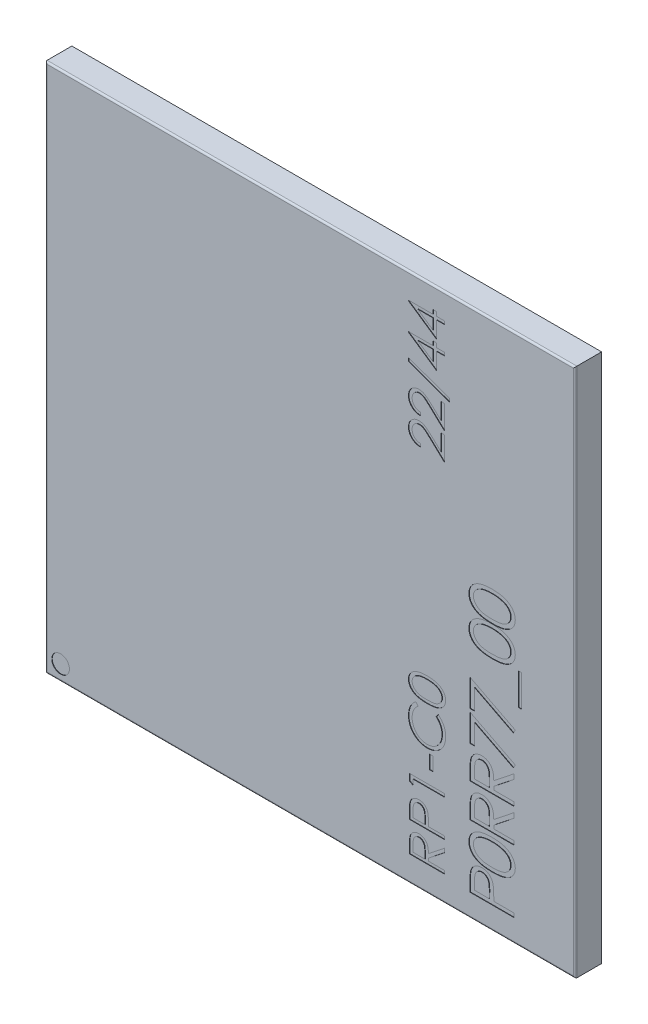
from build123d import *

# Parameters (mm, degrees)
SKETCH1_W                  = 12
SKETCH1_H                  = 12
BOSS_EXTRUDE1_DEPTH        = 0.6
FILLET1_R                  = 0.04
SKETCH5_R                  = 2.5
BOSS_EXTRUDE3_DEPTH        = 0.1
SZKIC2_R                   = 0.2
SZKIC2_W                   = 0.082051282
SZKIC2_H                   = 0.307692307
SZKIC2_W_2                 = 0.064102564
SZKIC2_H_2                 = 0.717948718
WYTNIJ_WYCI_GNI_CIE2_DEPTH = 0.01


with BuildPart() as part:
    # Sketch1 → Boss-Extrude1 (new body)
    with BuildSketch(Plane.XY):
        Rectangle(SKETCH1_W, SKETCH1_H)
    extrude(amount=BOSS_EXTRUDE1_DEPTH)

    # Fillet1
    fillet1_edges = [part.edges().sort_by_distance(p)[0] for p in [
        (6, 0, 0.6),
        (0, 6, 0.6),
        (-6, 0, 0.6),
        (0, -6, 0.6),
    ]]
    fillet(fillet1_edges, radius=FILLET1_R)

    # Szkic2 → Wytnij-wyciągnięcie2 (cut)
    # profile 1 of 21: a face of its own
    with BuildSketch(Plane.XY.offset(0.6)):
        with Locations((-5.654744413, -5.65)):
            Circle(SZKIC2_R)
    # profile 2 of 21: a face of its own
    with BuildSketch(Plane.XY.offset(0.6)):
        with BuildLine():
            Line((2.246735223, -5.423905278), (2.246735223, -5.263809124))
            add(Edge.make_bspline(
                [(2.246735223, -5.263809124), (2.246770785, -5.253125438), (2.246839069, -5.232611576), (2.247219815, -5.2032234), (2.248311096, -5.176520064), (2.249250201, -5.152515529), (2.250962645, -5.131210237), (2.252599364, -5.112538856), (2.254741915, -5.096587382), (2.256731726, -5.086931188), (2.257632658, -5.082559124)],
                knots=[0, 0, 0, 0, 1.410062039, 2.707475311, 3.878576406, 4.937260626, 5.877586885, 6.699081471, 7.410979367, 8, 8, 8, 8], degree=3))
            add(Edge.make_bspline(
                [(2.257632658, -5.082559124), (2.25907878, -5.076706186), (2.261940174, -5.065125169), (2.267988026, -5.048450802), (2.274987006, -5.032562058), (2.283206525, -5.017523495), (2.292712154, -5.003415755), (2.303322871, -4.990073507), (2.315017246, -4.977540059), (2.327900698, -4.965978983), (2.341698728, -4.955477467), (2.356373465, -4.946266021), (2.371864234, -4.938482517), (2.388195162, -4.932374465), (2.405185849, -4.927249138), (2.423009711, -4.92380555), (2.441607247, -4.921660531), (2.454261265, -4.921448624), (2.46067753, -4.921341176)],
                knots=[0, 0, 0, 0, 1.02737844, 2.032840108, 3.019645024, 3.985760442, 4.950801802, 5.916702504, 6.889791722, 7.870143693, 8.864820395, 9.842884691, 10.820524757, 11.815201459, 12.812418953, 13.84314332, 14.906358105, 16, 16, 16, 16], degree=3))
            add(Edge.make_bspline(
                [(2.46067753, -4.921341176), (2.471336983, -4.921676947), (2.492136335, -4.922332123), (2.52232168, -4.928440718), (2.550479237, -4.93844678), (2.576573555, -4.95223496), (2.600095988, -4.969793697), (2.620756663, -4.990896507), (2.638045786, -5.015555161), (2.650034999, -5.038510433), (2.657713378, -5.058787964), (2.663115974, -5.075481293), (2.667290138, -5.093690888), (2.671029596, -5.113242279), (2.673852841, -5.134216828), (2.675920634, -5.156564266), (2.677212988, -5.180300529), (2.677405446, -5.196606602), (2.677504453, -5.204995022)],
                knots=[0, 0, 0, 0, 1.260483769, 2.459530307, 3.627416485, 4.787058657, 5.939039949, 7.08810263, 8.267026773, 9.491475466, 10.141966685, 10.831826277, 11.566392101, 12.351337768, 13.187381173, 14.07005841, 15.007169909, 16, 16, 16, 16], degree=3))
            Line((2.677504453, -5.204995022), (3.046735223, -4.911084765))
            Line((3.046735223, -4.911084765), (3.046735223, -4.999866817))
            Line((3.046735223, -4.999866817), (2.677504453, -5.293777073))
            Line((2.677504453, -5.293777073), (2.677504453, -5.352110407))
            Line((2.677504453, -5.352110407), (3.046735223, -5.352110407))
            Line((3.046735223, -5.352110407), (3.046735223, -5.423905278))
            Line((3.046735223, -5.423905278), (2.246735223, -5.423905278))
        make_face()
        with BuildLine():
            Line((2.328786505, -5.352110407), (2.595453171, -5.352110407))
            Line((2.595453171, -5.352110407), (2.596574966, -5.205636048))
            add(Edge.make_bspline(
                [(2.596574966, -5.205636048), (2.596577993, -5.198797181), (2.596583861, -5.185541509), (2.595670974, -5.166364226), (2.594632582, -5.148508159), (2.59304389, -5.132041839), (2.590997677, -5.116957143), (2.588434097, -5.103264116), (2.58546021, -5.090932236), (2.580809633, -5.076596277), (2.573763409, -5.060398705), (2.562819358, -5.043180338), (2.549669275, -5.028072603), (2.534198097, -5.015768474), (2.51745781, -5.005459619), (2.499276963, -4.99852217), (2.480245326, -4.993898654), (2.467169109, -4.993393181), (2.460517274, -4.993136048)],
                knots=[0, 0, 0, 0, 1.146477201, 2.22219935, 3.21835465, 4.145220026, 4.995151787, 5.769831222, 6.480173269, 7.120302478, 8.295254187, 9.430763426, 10.528629691, 11.636497428, 12.733230534, 13.811001502, 14.886462612, 16, 16, 16, 16], degree=3))
            add(Edge.make_bspline(
                [(2.460517274, -4.993136048), (2.454084296, -4.993411611), (2.441336481, -4.993957678), (2.422664582, -4.998391484), (2.405036577, -5.005971519), (2.388429704, -5.015943089), (2.373590549, -5.028457452), (2.360756092, -5.042849345), (2.350249322, -5.059115998), (2.343266142, -5.074185487), (2.339165228, -5.087762794), (2.336184556, -5.099495145), (2.334115858, -5.112816763), (2.332156424, -5.127667065), (2.330570209, -5.144074392), (2.32947606, -5.162086832), (2.328835277, -5.181592805), (2.32880314, -5.195112042), (2.328786505, -5.202110407)],
                knots=[0, 0, 0, 0, 1.100823979, 2.181431445, 3.263702604, 4.376021382, 5.48638238, 6.575013887, 7.666064109, 8.791843368, 9.405226397, 10.093019944, 10.863016055, 11.711746407, 12.658404307, 13.684961631, 14.801597923, 16, 16, 16, 16], degree=3))
            Line((2.328786505, -5.202110407), (2.328786505, -5.352110407))
        make_face(mode=Mode.SUBTRACT)
    # profile 3 of 21: a face of its own
    with BuildSketch(Plane.XY.offset(0.6)):
        with BuildLine():
            Line((2.246735223, -4.746982201), (2.246735223, -4.590091176))
            add(Edge.make_bspline(
                [(2.246735223, -4.590091176), (2.246747085, -4.579300111), (2.246769813, -4.558623953), (2.247458897, -4.528974798), (2.248379284, -4.502046859), (2.249655145, -4.4778982), (2.251162938, -4.456454521), (2.253277689, -4.437812852), (2.255485757, -4.421826668), (2.25773065, -4.412248051), (2.258754453, -4.407879637)],
                knots=[0, 0, 0, 0, 1.415646017, 2.712440637, 3.8905458, 4.950247383, 5.884950622, 6.709939814, 7.411656543, 8, 8, 8, 8], degree=3))
            add(Edge.make_bspline(
                [(2.258754453, -4.407879637), (2.260268101, -4.402349735), (2.263259729, -4.391420235), (2.269250581, -4.375670728), (2.276358257, -4.360689582), (2.284443397, -4.346409934), (2.29390399, -4.333091865), (2.304110662, -4.320291409), (2.315723011, -4.308460421), (2.328374782, -4.297438652), (2.341905509, -4.287251538), (2.35656103, -4.278692519), (2.371903796, -4.27120878), (2.38814233, -4.265081463), (2.405292396, -4.260524936), (2.423232116, -4.257142173), (2.441981661, -4.254985199), (2.454795517, -4.254779316), (2.461318556, -4.254674509)],
                knots=[0, 0, 0, 0, 0.999549623, 1.97554611, 2.93413192, 3.889860808, 4.833293765, 5.780583482, 6.742559327, 7.719844669, 8.705620613, 9.691528643, 10.674968152, 11.680406189, 12.713313868, 13.765869198, 14.862690416, 16, 16, 16, 16], degree=3))
            add(Edge.make_bspline(
                [(2.461318556, -4.254674509), (2.467896333, -4.254770835), (2.480766199, -4.254959302), (2.499594265, -4.25722131), (2.51758704, -4.260268211), (2.534704629, -4.264953252), (2.550845376, -4.271089406), (2.566255944, -4.278287589), (2.580674154, -4.286969539), (2.594152353, -4.2969455), (2.60670319, -4.308043007), (2.618235714, -4.320215108), (2.62868242, -4.33341266), (2.638066727, -4.347593723), (2.64617102, -4.362896545), (2.653429832, -4.379089037), (2.659526075, -4.396311944), (2.662732946, -4.408230233), (2.664363428, -4.414289894)],
                knots=[0, 0, 0, 0, 1.121902311, 2.195077645, 3.232258892, 4.234102512, 5.217864754, 6.176164875, 7.132989551, 8.084763148, 9.034132444, 9.988522005, 10.94243251, 11.903244335, 12.886203696, 13.894208494, 14.929344452, 16, 16, 16, 16], degree=3))
            add(Edge.make_bspline(
                [(2.664363428, -4.414289894), (2.665428458, -4.419301913), (2.667762533, -4.430286044), (2.670385968, -4.448374675), (2.672537471, -4.469445903), (2.674545271, -4.493428034), (2.675609154, -4.520376995), (2.676858326, -4.550230977), (2.677447742, -4.583091016), (2.677485001, -4.606009869), (2.677504453, -4.617975791)],
                knots=[0, 0, 0, 0, 0.601372724, 1.317943291, 2.144091499, 3.08771165, 4.142394186, 5.309582461, 6.595334295, 8, 8, 8, 8], degree=3))
            Line((2.677504453, -4.617975791), (2.677504453, -4.67518733))
            Line((2.677504453, -4.67518733), (3.046735223, -4.67518733))
            Line((3.046735223, -4.67518733), (3.046735223, -4.746982201))
            Line((3.046735223, -4.746982201), (2.246735223, -4.746982201))
        make_face()
        with BuildLine():
            Line((2.328786505, -4.67518733), (2.595453171, -4.67518733))
            Line((2.595453171, -4.67518733), (2.597215992, -4.535123227))
            add(Edge.make_bspline(
                [(2.597215992, -4.535123227), (2.597219758, -4.528284339), (2.597227027, -4.515082007), (2.596313026, -4.49601151), (2.595271974, -4.478315788), (2.593697444, -4.462061384), (2.591633484, -4.447191265), (2.589066743, -4.433833873), (2.586276288, -4.421789426), (2.581614129, -4.407934623), (2.574445582, -4.392361367), (2.564010163, -4.375348775), (2.550491575, -4.361042449), (2.53533438, -4.348685155), (2.518518036, -4.33868583), (2.50043091, -4.331631706), (2.48134096, -4.327288067), (2.468286065, -4.326745588), (2.461639069, -4.326469381)],
                knots=[0, 0, 0, 0, 1.160746174, 2.240796558, 3.240300023, 4.169675897, 5.012224395, 5.787635701, 6.478238024, 7.109103438, 8.265591281, 9.382545711, 10.479929969, 11.588830844, 12.694575677, 13.785760505, 14.872603606, 16, 16, 16, 16], degree=3))
            add(Edge.make_bspline(
                [(2.461639069, -4.326469381), (2.455207415, -4.326757989), (2.442422083, -4.327331705), (2.423683988, -4.33159586), (2.405801895, -4.338761579), (2.389120975, -4.348693897), (2.373997132, -4.360751299), (2.360836732, -4.3747543), (2.350327837, -4.390738724), (2.343283693, -4.405483978), (2.339159596, -4.41868817), (2.336180911, -4.430100698), (2.334126902, -4.443052583), (2.332161471, -4.457420761), (2.330574977, -4.473186992), (2.329473255, -4.49045148), (2.32883524, -4.509156733), (2.328803143, -4.522141945), (2.328786505, -4.528873227)],
                knots=[0, 0, 0, 0, 1.120540835, 2.227496496, 3.330685923, 4.466139262, 5.598993257, 6.692710361, 7.80064471, 8.921224235, 9.527843361, 10.209888745, 10.975318552, 11.811557897, 12.738105936, 13.73658638, 14.826690375, 16, 16, 16, 16], degree=3))
            Line((2.328786505, -4.528873227), (2.328786505, -4.67518733))
        make_face(mode=Mode.SUBTRACT)
    # profile 4 of 21: a face of its own
    with BuildSketch(Plane.XY.offset(0.6)):
        Polygon((2.246735223, -3.992334765), (2.246735223, -3.844418099), (3.046735223, -3.844418099), (3.046735223, -3.916212971), (2.328786505, -3.916212971), (2.328786505, -4.039289894), align=None)
    # profile 5 of 21: a face of its own
    with BuildSketch(Plane.XY.offset(0.6)):
        with Locations((2.739042915, -3.393136048)):
            Rectangle(SZKIC2_W, SZKIC2_H)
    # profile 6 of 21: a face of its own
    with BuildSketch(Plane.XY.offset(0.6)):
        with BuildLine():
            Line((2.393530094, -2.367495022), (2.441607017, -2.430315535))
            add(Edge.make_bspline(
                [(2.441607017, -2.430315535), (2.436266295, -2.434796927), (2.425656855, -2.443699291), (2.410757635, -2.45802072), (2.396803744, -2.472949335), (2.383705527, -2.488464367), (2.371989427, -2.504924868), (2.360742985, -2.521703647), (2.350896339, -2.539410352), (2.338867428, -2.563771006), (2.32658895, -2.595763156), (2.316028399, -2.635896835), (2.309369158, -2.677850165), (2.308643025, -2.706465665), (2.308273684, -2.721020663)],
                knots=[0, 0, 0, 0, 0.75789156, 1.505565099, 2.245254514, 2.979266606, 3.711207489, 4.440978832, 5.174393176, 5.91211879, 7.394186119, 8.890401545, 10.418332761, 12, 12, 12, 12], degree=3))
            add(Edge.make_bspline(
                [(2.308273684, -2.721020663), (2.308366018, -2.729039703), (2.30854983, -2.745003358), (2.310974773, -2.768694438), (2.314383049, -2.791943135), (2.319440266, -2.814734328), (2.325834008, -2.837039004), (2.333474103, -2.859002981), (2.342926635, -2.880308264), (2.353374248, -2.901249562), (2.365174768, -2.921313433), (2.378046531, -2.940297257), (2.391844673, -2.958132905), (2.406623934, -2.974830419), (2.422306643, -2.990421845), (2.439068499, -3.004710989), (2.456730312, -3.017888764), (2.47530675, -3.029880067), (2.494624801, -3.040675025), (2.51479476, -3.049751906), (2.535471276, -3.057679592), (2.556800932, -3.064051395), (2.578641959, -3.069055608), (2.601084839, -3.072515291), (2.624087021, -3.074912131), (2.639677694, -3.0750951), (2.647536505, -3.07518733)],
                knots=[0, 0, 0, 0, 1.054877232, 2.099964208, 3.13098259, 4.145888998, 5.169474743, 6.183358035, 7.203388855, 8.234598956, 9.261847606, 10.264062591, 11.251197969, 12.227332808, 13.196685059, 14.158975844, 15.123498106, 16.094582253, 17.066912473, 18.032714859, 19.002806091, 19.979168736, 20.95977404, 21.949109834, 22.966205168, 24, 24, 24, 24], degree=3))
            add(Edge.make_bspline(
                [(2.647536505, -3.07518733), (2.659360543, -3.074898238), (2.682575473, -3.074330644), (2.716583926, -3.069300625), (2.749195322, -3.061595621), (2.780188853, -3.050236983), (2.809822887, -3.035951694), (2.837738051, -3.018127591), (2.86434331, -2.997406027), (2.8889943, -2.973574424), (2.911511405, -2.947423831), (2.931340193, -2.919367349), (2.947869287, -2.889473749), (2.961623795, -2.85807339), (2.97219676, -2.82492456), (2.979639989, -2.790086892), (2.984495344, -2.75363615), (2.984960187, -2.728728858), (2.985196761, -2.716052714)],
                knots=[0, 0, 0, 0, 1.029159485, 2.020618137, 2.987588728, 3.942669054, 4.889339625, 5.846988364, 6.821327795, 7.821533711, 8.827683044, 9.822769455, 10.807800696, 11.797391277, 12.803701919, 13.832062008, 14.896664671, 16, 16, 16, 16], degree=3))
            add(Edge.make_bspline(
                [(2.985196761, -2.716052714), (2.984810754, -2.702086385), (2.984051, -2.674597309), (2.977614601, -2.634284617), (2.967178505, -2.595693585), (2.952573266, -2.558822137), (2.933586914, -2.523774218), (2.910570257, -2.490494981), (2.883304352, -2.458956336), (2.862485351, -2.439991472), (2.851863428, -2.430315535)],
                knots=[0, 0, 0, 0, 1.028121516, 2.023589091, 2.998037872, 3.967518031, 4.937445131, 5.927275754, 6.942489185, 8, 8, 8, 8], degree=3))
            Line((2.851863428, -2.430315535), (2.899459581, -2.367495022))
            add(Edge.make_bspline(
                [(2.899459581, -2.367495022), (2.90598243, -2.372550767), (2.918996884, -2.382638041), (2.937348052, -2.398968673), (2.95459361, -2.416184734), (2.970647434, -2.434330476), (2.985575974, -2.453437883), (2.999387339, -2.4735052), (3.012008232, -2.494515299), (3.023601142, -2.516301299), (3.033808306, -2.538913401), (3.042853345, -2.562152541), (3.050341638, -2.586161209), (3.056675893, -2.610737303), (3.061192503, -2.636102782), (3.064789176, -2.66196279), (3.06692299, -2.688559368), (3.06713872, -2.706486977), (3.067248043, -2.715571945)],
                knots=[0, 0, 0, 0, 0.986911346, 1.969095443, 2.935967484, 3.900112155, 4.865124501, 5.834589912, 6.812044781, 7.795288262, 8.784678562, 9.777857908, 10.776141921, 11.791195789, 12.811324908, 13.855933174, 14.913475973, 16, 16, 16, 16], degree=3))
            add(Edge.make_bspline(
                [(3.067248043, -2.715571945), (3.067188159, -2.724176212), (3.067069746, -2.741190084), (3.065151536, -2.766309798), (3.062534453, -2.79076456), (3.058593852, -2.814484474), (3.053943717, -2.837598983), (3.047710287, -2.859898545), (3.04072762, -2.881602593), (3.032520766, -2.902623928), (3.023259925, -2.922980431), (3.012793283, -2.942606445), (3.001208856, -2.961492944), (2.988761997, -2.979825611), (2.975052899, -2.99733363), (2.960271954, -3.014168722), (2.94446898, -3.030425288), (2.933073585, -3.040483045), (2.927344197, -3.045539894)],
                knots=[0, 0, 0, 0, 1.114604814, 2.203992996, 3.262667896, 4.300477797, 5.318619304, 6.316056647, 7.298880507, 8.271930387, 9.238335007, 10.195173496, 11.151986948, 12.108099108, 13.064862484, 14.031167946, 15.010108607, 16, 16, 16, 16], degree=3))
            add(Edge.make_bspline(
                [(2.927344197, -3.045539894), (2.91739172, -3.053638941), (2.897606921, -3.069739257), (2.865544576, -3.090347191), (2.832098581, -3.107928657), (2.79707521, -3.122302604), (2.760460848, -3.133343472), (2.722314397, -3.14110592), (2.682712113, -3.146115016), (2.655778369, -3.146689956), (2.642087787, -3.146982201)],
                knots=[0, 0, 0, 0, 0.994611881, 1.977215934, 2.950189954, 3.921972279, 4.908960509, 5.911694611, 6.938501887, 8, 8, 8, 8], degree=3))
            add(Edge.make_bspline(
                [(2.642087787, -3.146982201), (2.627697969, -3.146626729), (2.5993869, -3.145927358), (2.557838568, -3.139985462), (2.518032534, -3.13042688), (2.480043107, -3.116850448), (2.443670471, -3.099637797), (2.409192482, -3.07837457), (2.376388642, -3.053307795), (2.345756698, -3.024634065), (2.317747704, -2.993190103), (2.293106286, -2.959517231), (2.272599425, -2.923681358), (2.255457445, -2.886077277), (2.242281567, -2.846423407), (2.233057982, -2.804804351), (2.227316927, -2.761298314), (2.226591165, -2.731615474), (2.226222402, -2.716533483)],
                knots=[0, 0, 0, 0, 1.032925535, 2.032216505, 3.007276963, 3.968222605, 4.92396291, 5.891752235, 6.871517503, 7.883894988, 8.900124299, 9.891468569, 10.874487609, 11.85992873, 12.854644235, 13.869047385, 14.917252991, 16, 16, 16, 16], degree=3))
            add(Edge.make_bspline(
                [(2.226222402, -2.716533483), (2.226332701, -2.707341634), (2.226551026, -2.689147295), (2.228676755, -2.662231966), (2.23222783, -2.636029612), (2.237035752, -2.610512676), (2.243090359, -2.585607388), (2.250636339, -2.56136034), (2.259620359, -2.537830908), (2.269879693, -2.515026735), (2.281416256, -2.493101762), (2.29409397, -2.472069754), (2.307848778, -2.452014559), (2.322821498, -2.433040416), (2.338887933, -2.41512411), (2.355859888, -2.39799987), (2.374172875, -2.382166165), (2.387065876, -2.372394355), (2.393530094, -2.367495022)],
                knots=[0, 0, 0, 0, 1.096622143, 2.170653093, 3.219033441, 4.250379162, 5.267604342, 6.275621678, 7.278284436, 8.271072515, 9.257558938, 10.232633088, 11.19973724, 12.157384997, 13.114417402, 14.069920322, 15.032307892, 16, 16, 16, 16], degree=3))
        make_face()
    # profile 7 of 21: a face of its own
    with BuildSketch(Plane.XY.offset(0.6)):
        with BuildLine():
            add(Edge.make_bspline(
                [(2.647055735, -2.27518733), (2.634233475, -2.275112354), (2.60932605, -2.274966713), (2.573032418, -2.273346502), (2.538984352, -2.270654996), (2.507180223, -2.266966453), (2.477611819, -2.262477772), (2.450358162, -2.256485659), (2.425293103, -2.24967131), (2.402334941, -2.241773589), (2.381174251, -2.232862162), (2.361420174, -2.223162665), (2.343101115, -2.212291553), (2.325929992, -2.200865251), (2.310169059, -2.188438932), (2.295636719, -2.175279042), (2.282455526, -2.161122381), (2.270616453, -2.146106254), (2.260235314, -2.130332434), (2.251034937, -2.114231961), (2.243456636, -2.097517153), (2.237257377, -2.080408053), (2.232196779, -2.062868601), (2.228720667, -2.044903275), (2.226537392, -2.026470429), (2.226328395, -2.014029031), (2.226222402, -2.007719381)],
                knots=[0, 0, 0, 0, 1.646148282, 3.197666765, 4.66315463, 6.030252048, 7.307778049, 8.501004361, 9.610818041, 10.641065266, 11.615491391, 12.557119604, 13.464013759, 14.348536654, 15.203310953, 16.038349431, 16.863300206, 17.683791446, 18.490318933, 19.285717724, 20.06220424, 20.843281102, 21.620494212, 22.403315558, 23.190242141, 24, 24, 24, 24], degree=3))
            add(Edge.make_bspline(
                [(2.226222402, -2.007719381), (2.226310688, -2.0013539), (2.226486345, -1.988688834), (2.228958829, -1.970031657), (2.232150136, -1.951699457), (2.237268467, -1.933970368), (2.243393214, -1.916509168), (2.25147472, -1.899750083), (2.260263986, -1.883101426), (2.27098615, -1.867319526), (2.282835906, -1.851932846), (2.296288409, -1.837509441), (2.310971359, -1.823680609), (2.327212228, -1.810968659), (2.344761997, -1.798828776), (2.363767782, -1.787721801), (2.384187464, -1.77741673), (2.405926381, -1.767719855), (2.429565213, -1.759240193), (2.454956518, -1.751701097), (2.482330226, -1.745521531), (2.511533849, -1.740411139), (2.542712061, -1.736444502), (2.575801692, -1.73355765), (2.610823442, -1.7320322), (2.634768101, -1.731744979), (2.647055735, -1.731597586)],
                knots=[0, 0, 0, 0, 0.810910589, 1.61342667, 2.396193133, 3.181089899, 3.963115317, 4.752255436, 5.550715454, 6.36105385, 7.181178335, 8.024612154, 8.872680183, 9.750181803, 10.651284446, 11.591556747, 12.554036451, 13.566402641, 14.62422919, 15.753422176, 16.94128843, 18.199818041, 19.531985927, 20.947085226, 22.433341622, 24, 24, 24, 24], degree=3))
            add(Edge.make_bspline(
                [(2.647055735, -1.731597586), (2.659289664, -1.731748222), (2.683180335, -1.732042386), (2.718046147, -1.733524934), (2.750957417, -1.736515014), (2.781949234, -1.740200665), (2.811035967, -1.745368175), (2.838198662, -1.751594598), (2.863533488, -1.758688681), (2.886858924, -1.767298482), (2.908560118, -1.776769655), (2.928829655, -1.787063668), (2.947830421, -1.798107964), (2.96542648, -1.810065777), (2.981602161, -1.822986825), (2.996335471, -1.836805965), (3.009873537, -1.851355303), (3.021853843, -1.866831684), (3.03265764, -1.882760584), (3.041765863, -1.899410931), (3.049657604, -1.9163566), (3.05610983, -1.933766777), (3.061113607, -1.951614581), (3.06455343, -1.969959346), (3.066971362, -1.988691467), (3.067155497, -2.001354781), (3.067248043, -2.007719381)],
                knots=[0, 0, 0, 0, 1.561645053, 3.049612875, 4.452756685, 5.778837748, 7.032101753, 8.221335837, 9.334924186, 10.387562255, 11.392109817, 12.355697819, 13.287721948, 14.19548756, 15.068665045, 15.927346723, 16.771751757, 17.602390507, 18.423119567, 19.225778204, 20.022010933, 20.807278863, 21.593079439, 22.384715467, 23.188155646, 24, 24, 24, 24], degree=3))
            add(Edge.make_bspline(
                [(3.067248043, -2.007719381), (3.067141448, -2.014028893), (3.066931262, -2.026470018), (3.064756695, -2.044904858), (3.06126058, -2.062797988), (3.056365356, -2.080237704), (3.050373392, -2.097313476), (3.042566843, -2.113792638), (3.033576172, -2.129858355), (3.023337319, -2.145468002), (3.011606266, -2.160327358), (2.998633029, -2.174523483), (2.984084931, -2.187686619), (2.968191016, -2.20000519), (2.950994346, -2.211552289), (2.932483381, -2.22232946), (2.912626513, -2.232232362), (2.891298588, -2.24129604), (2.86817748, -2.249332001), (2.843048528, -2.256402863), (2.815656496, -2.262050143), (2.78614046, -2.266837085), (2.754440445, -2.270672925), (2.720544982, -2.273345385), (2.684518436, -2.274965483), (2.659771179, -2.275112031), (2.647055735, -2.27518733)],
                knots=[0, 0, 0, 0, 0.810927267, 1.598990287, 2.382942141, 3.152806972, 3.926217614, 4.706701772, 5.493896336, 6.292070767, 7.104102563, 7.925577746, 8.761822141, 9.623241997, 10.509042271, 11.423174113, 12.375371989, 13.360203808, 14.400680605, 15.520553799, 16.714061498, 17.994519714, 19.364400916, 20.818312473, 22.365209998, 24, 24, 24, 24], degree=3))
        make_face()
        with BuildLine():
            add(Edge.make_bspline(
                [(2.646735223, -2.203392458), (2.657420597, -2.203364557), (2.67815881, -2.203310407), (2.708241741, -2.201936714), (2.736347234, -2.200024673), (2.76246432, -2.197619216), (2.786501721, -2.194016701), (2.808559367, -2.189929428), (2.828596433, -2.185026994), (2.846788016, -2.179197933), (2.863391718, -2.172558065), (2.878850086, -2.165321224), (2.893346331, -2.157477909), (2.906845282, -2.148867348), (2.91918193, -2.139319305), (2.930668981, -2.129276428), (2.940906924, -2.11828629), (2.953187784, -2.103086111), (2.965877666, -2.083018026), (2.976928263, -2.057733447), (2.983872809, -2.031752063), (2.984755955, -2.014117494), (2.985196761, -2.005315535)],
                knots=[0, 0, 0, 0, 1.459098681, 2.831824031, 4.11146945, 5.306290378, 6.412266529, 7.42953815, 8.369053297, 9.227277979, 10.03601793, 10.809473603, 11.557037441, 12.285528272, 12.993193355, 13.685654407, 14.36688038, 15.041354379, 16.352855396, 17.594313975, 18.799247529, 20, 20, 20, 20], degree=3))
            add(Edge.make_bspline(
                [(2.985196761, -2.005315535), (2.984810783, -1.996462624), (2.984040196, -1.978788205), (2.977314817, -1.952830688), (2.966381486, -1.927839491), (2.953890415, -1.908116703), (2.9419186, -1.893153595), (2.931723244, -1.882428819), (2.920304127, -1.872586313), (2.907984464, -1.863250912), (2.894527847, -1.854688857), (2.879999272, -1.846902992), (2.864358313, -1.839798228), (2.853439517, -1.835750446), (2.847857017, -1.833680919)],
                knots=[0, 0, 0, 0, 1.353621445, 2.702441307, 4.075953605, 5.516772412, 6.261413105, 7.007624062, 7.778524365, 8.566925914, 9.372323995, 10.217594641, 11.088702136, 12, 12, 12, 12], degree=3))
            add(Edge.make_bspline(
                [(2.847857017, -1.833680919), (2.840718791, -1.831269087), (2.826225131, -1.826372032), (2.80374201, -1.820060769), (2.780152807, -1.815090392), (2.755598495, -1.810618766), (2.729897992, -1.807566639), (2.703130818, -1.805109996), (2.675276793, -1.803662982), (2.656352223, -1.80348361), (2.646735223, -1.803392458)],
                knots=[0, 0, 0, 0, 0.884706709, 1.796334032, 2.740027952, 3.714592787, 4.726048262, 5.777819803, 6.87074269, 8, 8, 8, 8], degree=3))
            add(Edge.make_bspline(
                [(2.646735223, -1.803392458), (2.637119777, -1.803518215), (2.618309911, -1.803764224), (2.590762898, -1.804704564), (2.564598839, -1.80713281), (2.539705017, -1.809829751), (2.516219233, -1.813806258), (2.493944879, -1.818093759), (2.473157895, -1.82385403), (2.453532871, -1.830007143), (2.435292643, -1.837049443), (2.418352618, -1.844801873), (2.402629454, -1.853080217), (2.38817173, -1.862075927), (2.374895585, -1.871663703), (2.363106503, -1.882187308), (2.352231009, -1.892978415), (2.340038778, -1.908325644), (2.327509247, -1.928254488), (2.316292473, -1.953223758), (2.309654083, -1.979065877), (2.308733485, -1.996571958), (2.308273684, -2.005315535)],
                knots=[0, 0, 0, 0, 1.313483664, 2.569454835, 3.763100662, 4.901599063, 5.988328865, 7.015709358, 7.99797933, 8.932480776, 9.824041341, 10.666387587, 11.475829342, 12.24921787, 12.990555181, 13.709176526, 14.405678811, 15.080244297, 16.38186033, 17.610124501, 18.806354173, 20, 20, 20, 20], degree=3))
            add(Edge.make_bspline(
                [(2.308273684, -2.005315535), (2.308734629, -2.014165014), (2.309657359, -2.031880095), (2.316261772, -2.057998183), (2.327476429, -2.083136136), (2.340014638, -2.103130697), (2.352184263, -2.118291483), (2.362542015, -2.129049933), (2.373754702, -2.139232091), (2.38620079, -2.148532889), (2.399652178, -2.157092391), (2.413960961, -2.165238822), (2.429448213, -2.172378887), (2.446038895, -2.179040072), (2.46423148, -2.184878856), (2.484341046, -2.189725275), (2.506451368, -2.194137366), (2.530664399, -2.197314791), (2.556787059, -2.200112724), (2.584964428, -2.201915723), (2.615150661, -2.2033167), (2.63599617, -2.203366699), (2.646735223, -2.203392458)],
                knots=[0, 0, 0, 0, 1.207546505, 2.417292871, 3.651582144, 4.952510111, 5.626719005, 6.30238548, 6.989136872, 7.692112372, 8.420316868, 9.164734959, 9.937886623, 10.746308695, 11.604196049, 12.543341915, 13.568754172, 14.680483261, 15.875568977, 17.154711427, 18.534182925, 20, 20, 20, 20], degree=3))
        make_face(mode=Mode.SUBTRACT)
    # profile 8 of 21: a face of its own
    with BuildSketch(Plane.XY.offset(0.6)):
        with BuildLine():
            Line((2.492889069, 2.750453696), (2.492889069, 2.678658824))
            add(Edge.make_bspline(
                [(2.492889069, 2.678658824), (2.483364294, 2.679126745), (2.464657891, 2.680045729), (2.437383855, 2.684349338), (2.411314187, 2.690507252), (2.386658207, 2.699213871), (2.363197908, 2.710026734), (2.341026476, 2.722993597), (2.32022849, 2.738352192), (2.300996754, 2.755770874), (2.283353881, 2.77468942), (2.268118397, 2.795102206), (2.255245786, 2.816552498), (2.244484359, 2.838975218), (2.23640668, 2.862623347), (2.230413163, 2.887282286), (2.226807141, 2.913060374), (2.226419533, 2.930623808), (2.226222402, 2.93955626)],
                knots=[0, 0, 0, 0, 1.10065271, 2.161652631, 3.183658789, 4.190468796, 5.17591951, 6.163126047, 7.15150782, 8.156236427, 9.156009102, 10.134482811, 11.092018607, 12.041330605, 13.001268258, 13.972401359, 14.968799086, 16, 16, 16, 16], degree=3))
            add(Edge.make_bspline(
                [(2.226222402, 2.93955626), (2.226426097, 2.948329009), (2.22682635, 2.965567146), (2.230315304, 2.990715445), (2.235661814, 3.014712953), (2.243584501, 3.037287708), (2.253525739, 3.058671389), (2.265888972, 3.078599231), (2.280089211, 3.097553109), (2.29683909, 3.114602802), (2.314711254, 3.130265001), (2.333798574, 3.14376487), (2.353535451, 3.155391064), (2.374076058, 3.16490674), (2.395487286, 3.172120045), (2.417563857, 3.177464414), (2.440560551, 3.180519543), (2.456128212, 3.180985852), (2.464042915, 3.181222927)],
                knots=[0, 0, 0, 0, 1.111674182, 2.184400057, 3.212814286, 4.223731311, 5.211378316, 6.196328225, 7.191884489, 8.207283132, 9.220262353, 10.201199469, 11.166417575, 12.120932471, 13.06540007, 14.026332106, 14.996573967, 16, 16, 16, 16], degree=3))
            add(Edge.make_bspline(
                [(2.464042915, 3.181222927), (2.475185272, 3.180835889), (2.497274454, 3.180068606), (2.529735065, 3.173505409), (2.561184722, 3.163254439), (2.586496968, 3.150913279), (2.606891264, 3.138459987), (2.62369121, 3.127248987), (2.641775476, 3.114050017), (2.661217256, 3.098975845), (2.681761945, 3.081766871), (2.703828709, 3.062870182), (2.727009518, 3.041797766), (2.742852638, 3.027020936), (2.751062146, 3.019363952)],
                knots=[0, 0, 0, 0, 1.184416499, 2.348048165, 3.509039915, 4.696071444, 5.333504901, 6.05069495, 6.844171097, 7.714965912, 8.667477798, 9.695072654, 10.805644396, 12, 12, 12, 12], degree=3))
            Line((2.751062146, 3.019363952), (2.96468394, 2.819203696))
            Line((2.96468394, 2.819203696), (2.96468394, 3.191479337))
            Line((2.96468394, 3.191479337), (3.046735223, 3.191479337))
            Line((3.046735223, 3.191479337), (3.046735223, 2.647889593))
            Line((3.046735223, 2.647889593), (2.715645479, 2.958146004))
            add(Edge.make_bspline(
                [(2.715645479, 2.958146004), (2.707760152, 2.965699806), (2.692614052, 2.980209115), (2.670501375, 3.000730847), (2.649987195, 3.019162616), (2.631110269, 3.035623734), (2.613594482, 3.049757107), (2.598007121, 3.062299332), (2.583663247, 3.072348609), (2.567036821, 3.083254986), (2.546736863, 3.093818181), (2.521929162, 3.102895291), (2.496391505, 3.108430114), (2.479133896, 3.109094076), (2.470453171, 3.109428055)],
                knots=[0, 0, 0, 0, 1.329631726, 2.553950428, 3.673215718, 4.687767853, 5.603093632, 6.413772471, 7.123043292, 7.734684054, 8.834405432, 9.900288307, 10.943827018, 12, 12, 12, 12], degree=3))
            add(Edge.make_bspline(
                [(2.470453171, 3.109428055), (2.464994566, 3.109282742), (2.454236703, 3.108996359), (2.438463958, 3.106468886), (2.423249143, 3.102649341), (2.408545459, 3.09717614), (2.394500739, 3.089951742), (2.381097886, 3.081157826), (2.368140408, 3.071011526), (2.355991083, 3.059274093), (2.34486395, 3.046380032), (2.335007016, 3.032758489), (2.326769505, 3.018347036), (2.320016706, 3.003206437), (2.314719476, 2.987378901), (2.311048944, 2.970833817), (2.308744376, 2.953616899), (2.308432565, 2.941860671), (2.308273684, 2.935870363)],
                knots=[0, 0, 0, 0, 0.991446411, 1.95395049, 2.89581595, 3.838931463, 4.798493298, 5.75982156, 6.748411868, 7.785213223, 8.824556874, 9.840280684, 10.836137867, 11.835679398, 12.848801643, 13.863922112, 14.911575587, 16, 16, 16, 16], degree=3))
            add(Edge.make_bspline(
                [(2.308273684, 2.935870363), (2.308430671, 2.929612602), (2.308738968, 2.917323394), (2.31107416, 2.899318413), (2.314614312, 2.882023844), (2.320236847, 2.865697736), (2.326880151, 2.849986559), (2.335319753, 2.835225721), (2.345126758, 2.821170148), (2.35649838, 2.808051025), (2.369275219, 2.79606909), (2.383356178, 2.78539336), (2.398639886, 2.776126827), (2.415063613, 2.768030571), (2.432790881, 2.761458605), (2.451754732, 2.756435954), (2.47187396, 2.752461879), (2.485767686, 2.751134208), (2.492889069, 2.750453696)],
                knots=[0, 0, 0, 0, 1.030878251, 2.024474673, 2.987898669, 3.934362936, 4.864849709, 5.795128259, 6.730474222, 7.685293701, 8.650606017, 9.611896181, 10.591709709, 11.591680886, 12.625074257, 13.701333388, 14.821793024, 16, 16, 16, 16], degree=3))
        make_face()
    # profile 9 of 21: a face of its own
    with BuildSketch(Plane.XY.offset(0.6)):
        with BuildLine():
            Line((2.492889069, 3.365838311), (2.492889069, 3.29404344))
            add(Edge.make_bspline(
                [(2.492889069, 3.29404344), (2.483364294, 3.29451136), (2.464657891, 3.295430344), (2.437383855, 3.299733953), (2.411314187, 3.305891868), (2.386658207, 3.314598486), (2.363197908, 3.325411349), (2.341026476, 3.338378213), (2.32022849, 3.353736807), (2.300996754, 3.371155489), (2.283353881, 3.390074035), (2.268118397, 3.410486822), (2.255245786, 3.431937113), (2.244484359, 3.454359833), (2.23640668, 3.478007962), (2.230413163, 3.502666901), (2.226807141, 3.528444989), (2.226419533, 3.546008423), (2.226222402, 3.554940876)],
                knots=[0, 0, 0, 0, 1.10065271, 2.161652631, 3.183658789, 4.190468796, 5.17591951, 6.163126047, 7.15150782, 8.156236427, 9.156009102, 10.134482811, 11.092018607, 12.041330605, 13.001268258, 13.972401359, 14.968799086, 16, 16, 16, 16], degree=3))
            add(Edge.make_bspline(
                [(2.226222402, 3.554940876), (2.226426097, 3.563713624), (2.22682635, 3.580951762), (2.230315304, 3.60610006), (2.235661814, 3.630097569), (2.243584501, 3.652672323), (2.253525739, 3.674056004), (2.265888972, 3.693983846), (2.280089211, 3.712937725), (2.29683909, 3.729987417), (2.314711254, 3.745649617), (2.333798574, 3.759149486), (2.353535451, 3.770775679), (2.374076058, 3.780291355), (2.395487286, 3.787504661), (2.417563857, 3.792849029), (2.440560551, 3.795904159), (2.456128212, 3.796370468), (2.464042915, 3.796607542)],
                knots=[0, 0, 0, 0, 1.111674182, 2.184400057, 3.212814286, 4.223731311, 5.211378316, 6.196328225, 7.191884489, 8.207283132, 9.220262353, 10.201199469, 11.166417575, 12.120932471, 13.06540007, 14.026332106, 14.996573967, 16, 16, 16, 16], degree=3))
            add(Edge.make_bspline(
                [(2.464042915, 3.796607542), (2.475185272, 3.796220505), (2.497274454, 3.795453221), (2.529735065, 3.788890024), (2.561184722, 3.778639054), (2.586496968, 3.766297895), (2.606891264, 3.753844602), (2.62369121, 3.742633602), (2.641775476, 3.729434633), (2.661217256, 3.71436046), (2.681761945, 3.697151486), (2.703828709, 3.678254798), (2.727009518, 3.657182381), (2.742852638, 3.642405551), (2.751062146, 3.634748568)],
                knots=[0, 0, 0, 0, 1.184416499, 2.348048165, 3.509039915, 4.696071444, 5.333504901, 6.05069495, 6.844171097, 7.714965912, 8.667477798, 9.695072654, 10.805644396, 12, 12, 12, 12], degree=3))
            Line((2.751062146, 3.634748568), (2.96468394, 3.434588311))
            Line((2.96468394, 3.434588311), (2.96468394, 3.806863952))
            Line((2.96468394, 3.806863952), (3.046735223, 3.806863952))
            Line((3.046735223, 3.806863952), (3.046735223, 3.263274209))
            Line((3.046735223, 3.263274209), (2.715645479, 3.573530619))
            add(Edge.make_bspline(
                [(2.715645479, 3.573530619), (2.707760152, 3.581084422), (2.692614052, 3.595593731), (2.670501375, 3.616115463), (2.649987195, 3.634547231), (2.631110269, 3.65100835), (2.613594482, 3.665141722), (2.598007121, 3.677683947), (2.583663247, 3.687733225), (2.567036821, 3.698639601), (2.546736863, 3.709202797), (2.521929162, 3.718279907), (2.496391505, 3.723814729), (2.479133896, 3.724478692), (2.470453171, 3.72481267)],
                knots=[0, 0, 0, 0, 1.329631726, 2.553950428, 3.673215718, 4.687767853, 5.603093632, 6.413772471, 7.123043292, 7.734684054, 8.834405432, 9.900288307, 10.943827018, 12, 12, 12, 12], degree=3))
            add(Edge.make_bspline(
                [(2.470453171, 3.72481267), (2.464994566, 3.724667358), (2.454236703, 3.724380975), (2.438463958, 3.721853501), (2.423249143, 3.718033957), (2.408545459, 3.712560755), (2.394500739, 3.705336357), (2.381097886, 3.696542442), (2.368140408, 3.686396142), (2.355991083, 3.674658709), (2.34486395, 3.661764647), (2.335007016, 3.648143104), (2.326769505, 3.633731652), (2.320016706, 3.618591052), (2.314719476, 3.602763517), (2.311048944, 3.586218432), (2.308744376, 3.569001514), (2.308432565, 3.557245286), (2.308273684, 3.551254978)],
                knots=[0, 0, 0, 0, 0.991446411, 1.95395049, 2.89581595, 3.838931463, 4.798493298, 5.75982156, 6.748411868, 7.785213223, 8.824556874, 9.840280684, 10.836137867, 11.835679398, 12.848801643, 13.863922112, 14.911575587, 16, 16, 16, 16], degree=3))
            add(Edge.make_bspline(
                [(2.308273684, 3.551254978), (2.308430671, 3.544997217), (2.308738968, 3.532708009), (2.31107416, 3.514703028), (2.314614312, 3.497408459), (2.320236847, 3.481082352), (2.326880151, 3.465371175), (2.335319753, 3.450610337), (2.345126758, 3.436554763), (2.35649838, 3.42343564), (2.369275219, 3.411453706), (2.383356178, 3.400777975), (2.398639886, 3.391511442), (2.415063613, 3.383415187), (2.432790881, 3.37684322), (2.451754732, 3.37182057), (2.47187396, 3.367846494), (2.485767686, 3.366518824), (2.492889069, 3.365838311)],
                knots=[0, 0, 0, 0, 1.030878251, 2.024474673, 2.987898669, 3.934362936, 4.864849709, 5.795128259, 6.730474222, 7.685293701, 8.650606017, 9.611896181, 10.591709709, 11.591680886, 12.625074257, 13.701333388, 14.821793024, 16, 16, 16, 16], degree=3))
        make_face()
    # profile 10 of 21: a face of its own
    with BuildSketch(Plane.XY.offset(0.6)):
        Polygon((2.226222402, 4.299171645), (3.159555735, 3.96455626), (3.159555735, 3.888915235), (2.226222402, 4.223530619), align=None)
    # profile 11 of 21: a face of its own
    with BuildSketch(Plane.XY.offset(0.6)):
        Polygon((2.226222402, 4.797408824), (2.226222402, 4.811992158), (2.780068556, 4.811992158), (2.780068556, 4.90429985), (2.862119838, 4.90429985), (2.862119838, 4.811992158), (3.046735223, 4.811992158), (3.046735223, 4.740197286), (2.862119838, 4.740197286), (2.862119838, 4.360710106), align=None)
        Polygon((2.780068556, 4.740197286), (2.432632658, 4.740197286), (2.780068556, 4.501735747), align=None, mode=Mode.SUBTRACT)
    # profile 12 of 21: a face of its own
    with BuildSketch(Plane.XY.offset(0.6)):
        Polygon((2.226222402, 5.41279344), (2.226222402, 5.427376773), (2.780068556, 5.427376773), (2.780068556, 5.519684465), (2.862119838, 5.519684465), (2.862119838, 5.427376773), (3.046735223, 5.427376773), (3.046735223, 5.355581901), (2.862119838, 5.355581901), (2.862119838, 4.976094722), align=None)
        Polygon((2.780068556, 5.355581901), (2.432632658, 5.355581901), (2.780068556, 5.117120363), align=None, mode=Mode.SUBTRACT)
    # profile 13 of 21: a face of its own
    with BuildSketch(Plane.XY.offset(0.6)):
        with BuildLine():
            Line((3.618897427, -5.490225819), (3.618897427, -5.294112037))
            add(Edge.make_bspline(
                [(3.618897427, -5.294112037), (3.618912254, -5.280623207), (3.618940665, -5.254778009), (3.619802021, -5.217716564), (3.620952504, -5.184056641), (3.622547331, -5.153870818), (3.624432071, -5.127066219), (3.627075511, -5.103764133), (3.629835595, -5.083781403), (3.632641711, -5.071808131), (3.633921465, -5.066347614)],
                knots=[0, 0, 0, 0, 1.415646017, 2.712440637, 3.8905458, 4.950247383, 5.884950622, 6.709939814, 7.411656543, 8, 8, 8, 8], degree=3))
            add(Edge.make_bspline(
                [(3.633921465, -5.066347614), (3.635813525, -5.059435236), (3.63955306, -5.045773362), (3.647041625, -5.026086477), (3.65592622, -5.007360045), (3.666032645, -4.989510485), (3.677858386, -4.972862898), (3.690616726, -4.956862328), (3.705132163, -4.942073593), (3.720946876, -4.928296383), (3.737860285, -4.91556249), (3.756179686, -4.904863717), (3.775358144, -4.895509043), (3.795656311, -4.887849896), (3.817093894, -4.882154237), (3.839518543, -4.877925784), (3.862955475, -4.875229566), (3.878972795, -4.874972213), (3.887126594, -4.874841204)],
                knots=[0, 0, 0, 0, 0.999549623, 1.97554611, 2.93413192, 3.889860808, 4.833293765, 5.780583482, 6.742559327, 7.719844669, 8.705620613, 9.691528643, 10.674968152, 11.680406189, 12.713313868, 13.765869198, 14.862690416, 16, 16, 16, 16], degree=3))
            add(Edge.make_bspline(
                [(3.887126594, -4.874841204), (3.895348816, -4.874961611), (3.911436148, -4.875197195), (3.93497123, -4.878024706), (3.957462199, -4.881833332), (3.978859185, -4.887689632), (3.999035119, -4.895359825), (4.018298328, -4.904357554), (4.036321092, -4.915209991), (4.05316884, -4.927679943), (4.068857386, -4.941551827), (4.083273042, -4.956766952), (4.096331424, -4.973263893), (4.108061808, -4.990990221), (4.118192174, -5.010118749), (4.127265689, -5.030359364), (4.134885992, -5.051887998), (4.138894581, -5.066785859), (4.140932683, -5.074360435)],
                knots=[0, 0, 0, 0, 1.121902311, 2.195077645, 3.232258892, 4.234102512, 5.217864754, 6.176164875, 7.132989551, 8.084763148, 9.034132444, 9.988522005, 10.94243251, 11.903244335, 12.886203696, 13.894208494, 14.929344452, 16, 16, 16, 16], degree=3))
            add(Edge.make_bspline(
                [(4.140932683, -5.074360435), (4.142263971, -5.080625459), (4.145181565, -5.094355623), (4.148460858, -5.116966411), (4.151150237, -5.143305446), (4.153659987, -5.17328311), (4.154989841, -5.206969311), (4.156551306, -5.244286789), (4.157288077, -5.285361838), (4.15733465, -5.314010404), (4.157358965, -5.328967806)],
                knots=[0, 0, 0, 0, 0.601372724, 1.317943291, 2.144091499, 3.08771165, 4.142394186, 5.309582461, 6.595334295, 8, 8, 8, 8], degree=3))
            Line((4.157358965, -5.328967806), (4.157358965, -5.400482229))
            Line((4.157358965, -5.400482229), (4.618897427, -5.400482229))
            Line((4.618897427, -5.400482229), (4.618897427, -5.490225819))
            Line((4.618897427, -5.490225819), (3.618897427, -5.490225819))
        make_face()
        with BuildLine():
            Line((3.72146153, -5.400482229), (4.054794863, -5.400482229))
            Line((4.054794863, -5.400482229), (4.056998388, -5.225402101))
            add(Edge.make_bspline(
                [(4.056998388, -5.225402101), (4.057003096, -5.216853491), (4.057012183, -5.200350576), (4.055869681, -5.176512454), (4.054568366, -5.154392802), (4.052600203, -5.134074798), (4.050020253, -5.115487149), (4.046811828, -5.098790409), (4.043323759, -5.08373485), (4.03749606, -5.066416346), (4.028535377, -5.046949777), (4.015491102, -5.025684036), (3.998592868, -5.007801129), (3.979646374, -4.992354512), (3.958625944, -4.979855355), (3.936017036, -4.9710377), (3.912154599, -4.965608151), (3.89583598, -4.964930052), (3.887527235, -4.964584794)],
                knots=[0, 0, 0, 0, 1.160746174, 2.240796558, 3.240300023, 4.169675897, 5.012224395, 5.787635701, 6.478238024, 7.109103438, 8.265591281, 9.382545711, 10.479929969, 11.588830844, 12.694575677, 13.785760505, 14.872603606, 16, 16, 16, 16], degree=3))
            add(Edge.make_bspline(
                [(3.887527235, -4.964584794), (3.879487667, -4.964945553), (3.863506002, -4.965662699), (3.840083383, -4.970992893), (3.817730767, -4.979950041), (3.796879617, -4.992365439), (3.777974814, -5.007437191), (3.761524314, -5.024940942), (3.748388195, -5.044921473), (3.739583015, -5.063353039), (3.734427894, -5.07985828), (3.730704537, -5.09412394), (3.728137026, -5.110313796), (3.725680238, -5.128274019), (3.72369712, -5.147981807), (3.722319967, -5.169562417), (3.721522449, -5.192943984), (3.721482328, -5.209175499), (3.72146153, -5.217589601)],
                knots=[0, 0, 0, 0, 1.120540835, 2.227496496, 3.330685923, 4.466139262, 5.598993257, 6.692710361, 7.80064471, 8.921224235, 9.527843361, 10.209888745, 10.975318552, 11.811557897, 12.738105936, 13.73658638, 14.826690375, 16, 16, 16, 16], degree=3))
            Line((3.72146153, -5.217589601), (3.72146153, -5.400482229))
        make_face(mode=Mode.SUBTRACT)
    # profile 14 of 21: a face of its own
    with BuildSketch(Plane.XY.offset(0.6)):
        with BuildLine():
            add(Edge.make_bspline(
                [(4.119298068, -4.844071973), (4.103270243, -4.843978254), (4.072135962, -4.843796202), (4.026768921, -4.841770939), (3.984208838, -4.838406556), (3.944453677, -4.833795877), (3.907493172, -4.828185027), (3.873426101, -4.820694885), (3.842094777, -4.812176949), (3.813397075, -4.802304797), (3.786946212, -4.791165513), (3.762253616, -4.779041142), (3.739354792, -4.765452253), (3.717890889, -4.751169374), (3.698189723, -4.735636476), (3.680024298, -4.719186614), (3.663547806, -4.701490787), (3.648748965, -4.682720629), (3.635772541, -4.663003354), (3.624272071, -4.642877762), (3.614799194, -4.621984253), (3.60705012, -4.600597878), (3.600724373, -4.578673563), (3.596379232, -4.556216904), (3.593650138, -4.533175847), (3.593388892, -4.517624099), (3.593256401, -4.509737037)],
                knots=[0, 0, 0, 0, 1.646148282, 3.197666765, 4.66315463, 6.030252048, 7.307778049, 8.501004361, 9.610818041, 10.641065266, 11.615491391, 12.557119604, 13.464013759, 14.348536654, 15.203310953, 16.038349431, 16.863300206, 17.683791446, 18.490318933, 19.285717724, 20.06220424, 20.843281102, 21.620494212, 22.403315558, 23.190242141, 24, 24, 24, 24], degree=3))
            add(Edge.make_bspline(
                [(3.593256401, -4.509737037), (3.593366758, -4.501780186), (3.59358633, -4.485948854), (3.596676936, -4.462627383), (3.600666069, -4.439712132), (3.607063983, -4.417550771), (3.614719917, -4.395724272), (3.624821799, -4.374775414), (3.635808381, -4.353964594), (3.649211086, -4.334237218), (3.664023282, -4.315003869), (3.68083891, -4.296974612), (3.699192597, -4.279688572), (3.719493684, -4.263798635), (3.741430895, -4.248623781), (3.765188126, -4.234740063), (3.790712729, -4.221858724), (3.817886375, -4.20973763), (3.847434915, -4.199138053), (3.879174046, -4.189714182), (3.913391181, -4.181989725), (3.94989571, -4.175601735), (3.988868475, -4.170643438), (4.030230514, -4.167034874), (4.074007702, -4.165128062), (4.103938525, -4.164769035), (4.119298068, -4.164584794)],
                knots=[0, 0, 0, 0, 0.810910589, 1.61342667, 2.396193133, 3.181089899, 3.963115317, 4.752255436, 5.550715454, 6.36105385, 7.181178335, 8.024612154, 8.872680183, 9.750181803, 10.651284446, 11.591556747, 12.554036451, 13.566402641, 14.62422919, 15.753422176, 16.94128843, 18.199818041, 19.531985927, 20.947085226, 22.433341622, 24, 24, 24, 24], degree=3))
            add(Edge.make_bspline(
                [(4.119298068, -4.164584794), (4.134590479, -4.164773088), (4.164453817, -4.165140794), (4.208036082, -4.166993978), (4.24917517, -4.170731579), (4.287914941, -4.175338642), (4.324273357, -4.18179803), (4.358226726, -4.189581059), (4.389895259, -4.198448662), (4.419052054, -4.209210914), (4.446178546, -4.22104988), (4.471515468, -4.233917396), (4.495266426, -4.247722766), (4.517261499, -4.262670033), (4.537481101, -4.278821343), (4.555897738, -4.296095267), (4.57282032, -4.31428194), (4.587795702, -4.333627416), (4.601300449, -4.353538541), (4.612685728, -4.374351475), (4.622550404, -4.395533562), (4.630615686, -4.417296282), (4.636870407, -4.439606037), (4.641170187, -4.462536994), (4.644192602, -4.485952145), (4.64442277, -4.501781287), (4.644538453, -4.509737037)],
                knots=[0, 0, 0, 0, 1.561645053, 3.049612875, 4.452756685, 5.778837748, 7.032101753, 8.221335837, 9.334924186, 10.387562255, 11.392109817, 12.355697819, 13.287721948, 14.19548756, 15.068665045, 15.927346723, 16.771751757, 17.602390507, 18.423119567, 19.225778204, 20.022010933, 20.807278863, 21.593079439, 22.384715467, 23.188155646, 24, 24, 24, 24], degree=3))
            add(Edge.make_bspline(
                [(4.644538453, -4.509737037), (4.644405208, -4.517623927), (4.644142476, -4.533175334), (4.641424267, -4.556218884), (4.637054123, -4.578585296), (4.630935094, -4.600384941), (4.623445139, -4.621729656), (4.613686952, -4.642328608), (4.602448614, -4.662410755), (4.589650047, -4.681922814), (4.574986231, -4.700497008), (4.558769685, -4.718242165), (4.540584562, -4.734696085), (4.520717169, -4.750094298), (4.499221332, -4.764528172), (4.476082625, -4.777999636), (4.45126154, -4.790378264), (4.424601634, -4.801707861), (4.395700249, -4.811752813), (4.364289059, -4.82059139), (4.330049019, -4.827650489), (4.293153974, -4.833634168), (4.253528955, -4.838428967), (4.211159626, -4.841769542), (4.166126444, -4.843794665), (4.135192372, -4.84397785), (4.119298068, -4.844071973)],
                knots=[0, 0, 0, 0, 0.810927267, 1.598990287, 2.382942141, 3.152806972, 3.926217614, 4.706701772, 5.493896336, 6.292070767, 7.104102563, 7.925577746, 8.761822141, 9.623241997, 10.509042271, 11.423174113, 12.375371989, 13.360203808, 14.400680605, 15.520553799, 16.714061498, 17.994519714, 19.364400916, 20.818312473, 22.365209998, 24, 24, 24, 24], degree=3))
        make_face()
        with BuildLine():
            add(Edge.make_bspline(
                [(4.118897427, -4.754328383), (4.132254145, -4.754293507), (4.158176911, -4.75422582), (4.195780575, -4.752508703), (4.230912441, -4.750118652), (4.263558799, -4.747111831), (4.293605549, -4.742608688), (4.321177608, -4.737499597), (4.34622394, -4.731371554), (4.368963419, -4.724085227), (4.389718047, -4.715785392), (4.409041007, -4.706739341), (4.427161313, -4.696935197), (4.444035002, -4.686171996), (4.459455812, -4.674236942), (4.473814625, -4.661683346), (4.486612054, -4.647945674), (4.501963129, -4.62894545), (4.517825482, -4.603860344), (4.531638728, -4.57225462), (4.54031941, -4.539777889), (4.541423343, -4.517734679), (4.54197435, -4.506732229)],
                knots=[0, 0, 0, 0, 1.459098681, 2.831824031, 4.11146945, 5.306290378, 6.412266529, 7.42953815, 8.369053297, 9.227277979, 10.03601793, 10.809473603, 11.557037441, 12.285528272, 12.993193355, 13.685654407, 14.36688038, 15.041354379, 16.352855396, 17.594313975, 18.799247529, 20, 20, 20, 20], degree=3))
            add(Edge.make_bspline(
                [(4.54197435, -4.506732229), (4.541491877, -4.495666091), (4.540528644, -4.473573068), (4.53212192, -4.44112617), (4.518455257, -4.409887174), (4.502841418, -4.38523369), (4.487876648, -4.366529804), (4.475132454, -4.353123834), (4.460858557, -4.340820702), (4.445458979, -4.329151452), (4.428638208, -4.318448883), (4.410477489, -4.308716551), (4.390926291, -4.299835596), (4.377277794, -4.294775868), (4.370299671, -4.29218896)],
                knots=[0, 0, 0, 0, 1.353621445, 2.702441307, 4.075953605, 5.516772412, 6.261413105, 7.007624062, 7.778524365, 8.566925914, 9.372323995, 10.217594641, 11.088702136, 12, 12, 12, 12], degree=3))
            add(Edge.make_bspline(
                [(4.370299671, -4.29218896), (4.361376888, -4.289174169), (4.343259812, -4.283052851), (4.315155912, -4.275163773), (4.285669408, -4.268950802), (4.254976517, -4.263361269), (4.222850888, -4.25954611), (4.189391922, -4.256475306), (4.15457439, -4.254666538), (4.130918678, -4.254442324), (4.118897427, -4.254328383)],
                knots=[0, 0, 0, 0, 0.884706709, 1.796334032, 2.740027952, 3.714592787, 4.726048262, 5.777819803, 6.87074269, 8, 8, 8, 8], degree=3))
            add(Edge.make_bspline(
                [(4.118897427, -4.254328383), (4.106878121, -4.25448558), (4.083365788, -4.254793091), (4.048932022, -4.255968516), (4.016226947, -4.259003823), (3.98510967, -4.262375), (3.95575244, -4.267345634), (3.927909497, -4.27270501), (3.901925768, -4.279905348), (3.877394487, -4.28759674), (3.854594203, -4.296399615), (3.833419172, -4.306090152), (3.813765216, -4.316438082), (3.795693061, -4.32768272), (3.77909788, -4.33966744), (3.764361527, -4.352821946), (3.75076716, -4.36631083), (3.735526871, -4.385494866), (3.719864958, -4.410405921), (3.70584399, -4.441617509), (3.697546002, -4.473920157), (3.696395255, -4.495802758), (3.695820504, -4.506732229)],
                knots=[0, 0, 0, 0, 1.313483664, 2.569454835, 3.763100662, 4.901599063, 5.988328865, 7.015709358, 7.99797933, 8.932480776, 9.824041341, 10.666387587, 11.475829342, 12.24921787, 12.990555181, 13.709176526, 14.405678811, 15.080244297, 16.38186033, 17.610124501, 18.806354173, 20, 20, 20, 20], degree=3))
            add(Edge.make_bspline(
                [(3.695820504, -4.506732229), (3.696396685, -4.517794079), (3.697550098, -4.539937929), (3.705805614, -4.572585539), (3.719823935, -4.60400798), (3.735496696, -4.629001183), (3.750708727, -4.647952165), (3.763655917, -4.661400227), (3.777671776, -4.674127925), (3.793229387, -4.685753922), (3.810043621, -4.6964533), (3.8279296, -4.706636339), (3.847288665, -4.71556142), (3.868027018, -4.723887901), (3.890767748, -4.731186381), (3.915904706, -4.737244405), (3.943542609, -4.742759518), (3.973808898, -4.746731299), (4.006462223, -4.750228716), (4.041683933, -4.752482465), (4.079416725, -4.754233686), (4.105473611, -4.754296185), (4.118897427, -4.754328383)],
                knots=[0, 0, 0, 0, 1.207546505, 2.417292871, 3.651582144, 4.952510111, 5.626719005, 6.30238548, 6.989136872, 7.692112372, 8.420316868, 9.164734959, 9.937886623, 10.746308695, 11.604196049, 12.543341915, 13.568754172, 14.680483261, 15.875568977, 17.154711427, 18.534182925, 20, 20, 20, 20], degree=3))
        make_face(mode=Mode.SUBTRACT)
    # profile 15 of 21: a face of its own
    with BuildSketch(Plane.XY.offset(0.6)):
        with BuildLine():
            Line((3.618897427, -4.069712999), (3.618897427, -3.869592806))
            add(Edge.make_bspline(
                [(3.618897427, -3.869592806), (3.61894188, -3.856238198), (3.619027235, -3.830595871), (3.619503167, -3.793860651), (3.620867269, -3.760481481), (3.62204115, -3.730475812), (3.624181705, -3.703844197), (3.626227604, -3.680504971), (3.628905793, -3.660565628), (3.631393056, -3.648495385), (3.632519222, -3.643030306)],
                knots=[0, 0, 0, 0, 1.410062039, 2.707475311, 3.878576406, 4.937260626, 5.877586885, 6.699081471, 7.410979367, 8, 8, 8, 8], degree=3))
            add(Edge.make_bspline(
                [(3.632519222, -3.643030306), (3.634326874, -3.635714134), (3.637903616, -3.621237862), (3.645463431, -3.600394904), (3.654212156, -3.580533973), (3.664486555, -3.56173577), (3.676368591, -3.544101095), (3.689631988, -3.527423284), (3.704249956, -3.511756474), (3.720354271, -3.49730513), (3.737601808, -3.484178235), (3.75594523, -3.472663926), (3.775308691, -3.462934547), (3.795722351, -3.455299482), (3.81696071, -3.448892823), (3.839240538, -3.444588338), (3.862487458, -3.441907064), (3.87830498, -3.441642181), (3.886325312, -3.44150787)],
                knots=[0, 0, 0, 0, 1.02737844, 2.032840108, 3.019645024, 3.985760442, 4.950801802, 5.916702504, 6.889791722, 7.870143693, 8.864820395, 9.842884691, 10.820524757, 11.815201459, 12.812418953, 13.84314332, 14.906358105, 16, 16, 16, 16], degree=3))
            add(Edge.make_bspline(
                [(3.886325312, -3.44150787), (3.899649627, -3.441927584), (3.925648818, -3.442746554), (3.963380498, -3.450382298), (3.998577445, -3.462889875), (4.031195342, -3.480125101), (4.060598384, -3.502073523), (4.086424228, -3.528452034), (4.108035631, -3.559275352), (4.123022147, -3.587969442), (4.132620121, -3.613316356), (4.139373366, -3.634183017), (4.144591071, -3.656945011), (4.149265394, -3.681384249), (4.15279445, -3.707602436), (4.155379191, -3.735536733), (4.156994633, -3.765207062), (4.157235206, -3.785589654), (4.157358965, -3.796075178)],
                knots=[0, 0, 0, 0, 1.260483769, 2.459530307, 3.627416485, 4.787058657, 5.939039949, 7.08810263, 8.267026773, 9.491475466, 10.141966685, 10.831826277, 11.566392101, 12.351337768, 13.187381173, 14.07005841, 15.007169909, 16, 16, 16, 16], degree=3))
            Line((4.157358965, -3.796075178), (4.618897427, -3.428687358))
            Line((4.618897427, -3.428687358), (4.618897427, -3.539664922))
            Line((4.618897427, -3.539664922), (4.157358965, -3.907052742))
            Line((4.157358965, -3.907052742), (4.157358965, -3.979969409))
            Line((4.157358965, -3.979969409), (4.618897427, -3.979969409))
            Line((4.618897427, -3.979969409), (4.618897427, -4.069712999))
            Line((4.618897427, -4.069712999), (3.618897427, -4.069712999))
        make_face()
        with BuildLine():
            Line((3.72146153, -3.979969409), (4.054794863, -3.979969409))
            Line((4.054794863, -3.979969409), (4.056197106, -3.79687646))
            add(Edge.make_bspline(
                [(4.056197106, -3.79687646), (4.056200891, -3.788327877), (4.056208225, -3.771758287), (4.055067117, -3.747786683), (4.053769127, -3.7254666), (4.051783262, -3.704883699), (4.049225494, -3.686027829), (4.04602102, -3.668911546), (4.042303662, -3.653496696), (4.03649044, -3.635576747), (4.027682661, -3.615329782), (4.014002596, -3.593806823), (3.997564993, -3.574922154), (3.97822602, -3.559541994), (3.957300661, -3.546655925), (3.934574603, -3.537984113), (3.910785056, -3.532204719), (3.894439785, -3.531572877), (3.886124991, -3.53125146)],
                knots=[0, 0, 0, 0, 1.146477201, 2.22219935, 3.21835465, 4.145220026, 4.995151787, 5.769831222, 6.480173269, 7.120302478, 8.295254187, 9.430763426, 10.528629691, 11.636497428, 12.733230534, 13.811001502, 14.886462612, 16, 16, 16, 16], degree=3))
            add(Edge.make_bspline(
                [(3.886124991, -3.53125146), (3.878083769, -3.531595915), (3.862149, -3.532278498), (3.838809126, -3.537820756), (3.81677412, -3.5472958), (3.796015529, -3.559760262), (3.777466585, -3.575403215), (3.761423514, -3.593393082), (3.748290051, -3.613726398), (3.739561076, -3.632563259), (3.734434934, -3.649534894), (3.730709093, -3.664200332), (3.728123221, -3.680852354), (3.725673929, -3.699415232), (3.72369116, -3.71992439), (3.722323474, -3.742439941), (3.721522495, -3.766822407), (3.721482324, -3.783721453), (3.72146153, -3.792469409)],
                knots=[0, 0, 0, 0, 1.100823979, 2.181431445, 3.263702604, 4.376021382, 5.48638238, 6.575013887, 7.666064109, 8.791843368, 9.405226397, 10.093019944, 10.863016055, 11.711746407, 12.658404307, 13.684961631, 14.801597923, 16, 16, 16, 16], degree=3))
            Line((3.72146153, -3.792469409), (3.72146153, -3.979969409))
        make_face(mode=Mode.SUBTRACT)
    # profile 16 of 21: a face of its own
    with BuildSketch(Plane.XY.offset(0.6)):
        with BuildLine():
            Line((3.618897427, -3.308174537), (3.618897427, -3.108054345))
            add(Edge.make_bspline(
                [(3.618897427, -3.108054345), (3.61894188, -3.094699737), (3.619027235, -3.06905741), (3.619503167, -3.03232219), (3.620867269, -2.998943019), (3.62204115, -2.968937351), (3.624181705, -2.942305735), (3.626227604, -2.918966509), (3.628905793, -2.899027167), (3.631393056, -2.886956924), (3.632519222, -2.881491845)],
                knots=[0, 0, 0, 0, 1.410062039, 2.707475311, 3.878576406, 4.937260626, 5.877586885, 6.699081471, 7.410979367, 8, 8, 8, 8], degree=3))
            add(Edge.make_bspline(
                [(3.632519222, -2.881491845), (3.634326874, -2.874175672), (3.637903616, -2.859699401), (3.645463431, -2.838856442), (3.654212156, -2.818995511), (3.664486555, -2.800197308), (3.676368591, -2.782562633), (3.689631988, -2.765884823), (3.704249956, -2.750218013), (3.720354271, -2.735766668), (3.737601808, -2.722639774), (3.75594523, -2.711125465), (3.775308691, -2.701396086), (3.795722351, -2.693761021), (3.81696071, -2.687354362), (3.839240538, -2.683049876), (3.862487458, -2.680368603), (3.87830498, -2.680103719), (3.886325312, -2.679969409)],
                knots=[0, 0, 0, 0, 1.02737844, 2.032840108, 3.019645024, 3.985760442, 4.950801802, 5.916702504, 6.889791722, 7.870143693, 8.864820395, 9.842884691, 10.820524757, 11.815201459, 12.812418953, 13.84314332, 14.906358105, 16, 16, 16, 16], degree=3))
            add(Edge.make_bspline(
                [(3.886325312, -2.679969409), (3.899649627, -2.680389123), (3.925648818, -2.681208093), (3.963380498, -2.688843837), (3.998577445, -2.701351414), (4.031195342, -2.718586639), (4.060598384, -2.740535061), (4.086424228, -2.766913573), (4.108035631, -2.79773689), (4.123022147, -2.826430981), (4.132620121, -2.851777895), (4.139373366, -2.872644556), (4.144591071, -2.895406549), (4.149265394, -2.919845788), (4.15279445, -2.946063975), (4.155379191, -2.973998272), (4.156994633, -3.003668601), (4.157235206, -3.024051192), (4.157358965, -3.034536717)],
                knots=[0, 0, 0, 0, 1.260483769, 2.459530307, 3.627416485, 4.787058657, 5.939039949, 7.08810263, 8.267026773, 9.491475466, 10.141966685, 10.831826277, 11.566392101, 12.351337768, 13.187381173, 14.07005841, 15.007169909, 16, 16, 16, 16], degree=3))
            Line((4.157358965, -3.034536717), (4.618897427, -2.667148896))
            Line((4.618897427, -2.667148896), (4.618897427, -2.77812646))
            Line((4.618897427, -2.77812646), (4.157358965, -3.145514281))
            Line((4.157358965, -3.145514281), (4.157358965, -3.218430947))
            Line((4.157358965, -3.218430947), (4.618897427, -3.218430947))
            Line((4.618897427, -3.218430947), (4.618897427, -3.308174537))
            Line((4.618897427, -3.308174537), (3.618897427, -3.308174537))
        make_face()
        with BuildLine():
            Line((3.72146153, -3.218430947), (4.054794863, -3.218430947))
            Line((4.054794863, -3.218430947), (4.056197106, -3.035337999))
            add(Edge.make_bspline(
                [(4.056197106, -3.035337999), (4.056200891, -3.026789415), (4.056208225, -3.010219825), (4.055067117, -2.986248222), (4.053769127, -2.963928138), (4.051783262, -2.943345238), (4.049225494, -2.924489368), (4.04602102, -2.907373084), (4.042303662, -2.891958235), (4.03649044, -2.874038286), (4.027682661, -2.85379132), (4.014002596, -2.832268362), (3.997564993, -2.813383693), (3.97822602, -2.798003532), (3.957300661, -2.785117463), (3.934574603, -2.776445652), (3.910785056, -2.770666257), (3.894439785, -2.770034415), (3.886124991, -2.769712999)],
                knots=[0, 0, 0, 0, 1.146477201, 2.22219935, 3.21835465, 4.145220026, 4.995151787, 5.769831222, 6.480173269, 7.120302478, 8.295254187, 9.430763426, 10.528629691, 11.636497428, 12.733230534, 13.811001502, 14.886462612, 16, 16, 16, 16], degree=3))
            add(Edge.make_bspline(
                [(3.886124991, -2.769712999), (3.878083769, -2.770057453), (3.862149, -2.770740036), (3.838809126, -2.776282294), (3.81677412, -2.785757338), (3.796015529, -2.7982218), (3.777466585, -2.813864754), (3.761423514, -2.83185462), (3.748290051, -2.852187937), (3.739561076, -2.871024798), (3.734434934, -2.887996432), (3.730709093, -2.902661871), (3.728123221, -2.919313893), (3.725673929, -2.93787677), (3.72369116, -2.958385929), (3.722323474, -2.980901479), (3.721522495, -3.005283945), (3.721482324, -3.022182992), (3.72146153, -3.030930947)],
                knots=[0, 0, 0, 0, 1.100823979, 2.181431445, 3.263702604, 4.376021382, 5.48638238, 6.575013887, 7.666064109, 8.791843368, 9.405226397, 10.093019944, 10.863016055, 11.711746407, 12.658404307, 13.684961631, 14.801597923, 16, 16, 16, 16], degree=3))
            Line((3.72146153, -3.030930947), (3.72146153, -3.218430947))
        make_face(mode=Mode.SUBTRACT)
    # profile 17 of 21: a face of its own
    with BuildSketch(Plane.XY.offset(0.6)):
        Polygon((3.618897427, -2.572277101), (3.618897427, -1.956892486), (4.644538453, -2.482533512), (4.601870183, -2.56005755), (3.72146153, -2.108735435), (3.72146153, -2.572277101), align=None)
    # profile 18 of 21: a face of its own
    with BuildSketch(Plane.XY.offset(0.6)):
        Polygon((3.618897427, -1.887661717), (3.618897427, -1.272277101), (4.644538453, -1.797918127), (4.601870183, -1.875442165), (3.72146153, -1.42412005), (3.72146153, -1.887661717), align=None)
    # profile 19 of 21: a face of its own
    with BuildSketch(Plane.XY.offset(0.6)):
        with Locations((4.753512812, -0.959456588)):
            Rectangle(SZKIC2_W_2, SZKIC2_H_2)
    # profile 20 of 21: a face of its own
    with BuildSketch(Plane.XY.offset(0.6)):
        with BuildLine():
            add(Edge.make_bspline(
                [(4.119298068, -0.659456588), (4.103270243, -0.659362869), (4.072135962, -0.659180818), (4.026768921, -0.657155554), (3.984208838, -0.653791171), (3.944453677, -0.649180493), (3.907493172, -0.643569642), (3.873426101, -0.636079501), (3.842094777, -0.627561564), (3.813397075, -0.617689413), (3.786946212, -0.606550128), (3.762253616, -0.594425757), (3.739354792, -0.580836868), (3.717890889, -0.56655399), (3.698189723, -0.551021092), (3.680024298, -0.534571229), (3.663547806, -0.516875402), (3.648748965, -0.498105244), (3.635772541, -0.47838797), (3.624272071, -0.458262377), (3.614799194, -0.437368868), (3.60705012, -0.415982493), (3.600724373, -0.394058178), (3.596379232, -0.37160152), (3.593650138, -0.348560462), (3.593388892, -0.333008715), (3.593256401, -0.325121653)],
                knots=[0, 0, 0, 0, 1.646148282, 3.197666765, 4.66315463, 6.030252048, 7.307778049, 8.501004361, 9.610818041, 10.641065266, 11.615491391, 12.557119604, 13.464013759, 14.348536654, 15.203310953, 16.038349431, 16.863300206, 17.683791446, 18.490318933, 19.285717724, 20.06220424, 20.843281102, 21.620494212, 22.403315558, 23.190242141, 24, 24, 24, 24], degree=3))
            add(Edge.make_bspline(
                [(3.593256401, -0.325121653), (3.593366758, -0.317164802), (3.59358633, -0.301333469), (3.596676936, -0.278011998), (3.600666069, -0.255096748), (3.607063983, -0.232935387), (3.614719917, -0.211108887), (3.624821799, -0.19016003), (3.635808381, -0.169349209), (3.649211086, -0.149621833), (3.664023282, -0.130388484), (3.68083891, -0.112359228), (3.699192597, -0.095073187), (3.719493684, -0.079183251), (3.741430895, -0.064008397), (3.765188126, -0.050124678), (3.790712729, -0.037243339), (3.817886375, -0.025122245), (3.847434915, -0.014522668), (3.879174046, -0.005098797), (3.913391181, 0.00262566), (3.94989571, 0.00901365), (3.988868475, 0.013971946), (4.030230514, 0.01758051), (4.074007702, 0.019487323), (4.103938525, 0.01984635), (4.119298068, 0.020030591)],
                knots=[0, 0, 0, 0, 0.810910589, 1.61342667, 2.396193133, 3.181089899, 3.963115317, 4.752255436, 5.550715454, 6.36105385, 7.181178335, 8.024612154, 8.872680183, 9.750181803, 10.651284446, 11.591556747, 12.554036451, 13.566402641, 14.62422919, 15.753422176, 16.94128843, 18.199818041, 19.531985927, 20.947085226, 22.433341622, 24, 24, 24, 24], degree=3))
            add(Edge.make_bspline(
                [(4.119298068, 0.020030591), (4.134590479, 0.019842296), (4.164453817, 0.019474591), (4.208036082, 0.017621406), (4.24917517, 0.013883806), (4.287914941, 0.009276743), (4.324273357, 0.002817355), (4.358226726, -0.004965674), (4.389895259, -0.013833277), (4.419052054, -0.024595529), (4.446178546, -0.036434495), (4.471515468, -0.049302011), (4.495266426, -0.063107382), (4.517261499, -0.078054648), (4.537481101, -0.094205958), (4.555897738, -0.111479882), (4.57282032, -0.129666556), (4.587795702, -0.149012032), (4.601300449, -0.168923156), (4.612685728, -0.189736091), (4.622550404, -0.210918177), (4.630615686, -0.232680898), (4.636870407, -0.254990652), (4.641170187, -0.277921609), (4.644192602, -0.30133676), (4.64442277, -0.317165903), (4.644538453, -0.325121653)],
                knots=[0, 0, 0, 0, 1.561645053, 3.049612875, 4.452756685, 5.778837748, 7.032101753, 8.221335837, 9.334924186, 10.387562255, 11.392109817, 12.355697819, 13.287721948, 14.19548756, 15.068665045, 15.927346723, 16.771751757, 17.602390507, 18.423119567, 19.225778204, 20.022010933, 20.807278863, 21.593079439, 22.384715467, 23.188155646, 24, 24, 24, 24], degree=3))
            add(Edge.make_bspline(
                [(4.644538453, -0.325121653), (4.644405208, -0.333008542), (4.644142476, -0.348559949), (4.641424267, -0.3716035), (4.637054123, -0.393969912), (4.630935094, -0.415769557), (4.623445139, -0.437114272), (4.613686952, -0.457713224), (4.602448614, -0.47779537), (4.589650047, -0.497307429), (4.574986231, -0.515881624), (4.558769685, -0.533626781), (4.540584562, -0.5500807), (4.520717169, -0.565478914), (4.499221332, -0.579912788), (4.476082625, -0.593384251), (4.45126154, -0.60576288), (4.424601634, -0.617092476), (4.395700249, -0.627137428), (4.364289059, -0.635976005), (4.330049019, -0.643035105), (4.293153974, -0.649018783), (4.253528955, -0.653813583), (4.211159626, -0.657154157), (4.166126444, -0.65917928), (4.135192372, -0.659362465), (4.119298068, -0.659456588)],
                knots=[0, 0, 0, 0, 0.810927267, 1.598990287, 2.382942141, 3.152806972, 3.926217614, 4.706701772, 5.493896336, 6.292070767, 7.104102563, 7.925577746, 8.761822141, 9.623241997, 10.509042271, 11.423174113, 12.375371989, 13.360203808, 14.400680605, 15.520553799, 16.714061498, 17.994519714, 19.364400916, 20.818312473, 22.365209998, 24, 24, 24, 24], degree=3))
        make_face()
        with BuildLine():
            add(Edge.make_bspline(
                [(4.118897427, -0.569712999), (4.132254145, -0.569678123), (4.158176911, -0.569610435), (4.195780575, -0.567893319), (4.230912441, -0.565503268), (4.263558799, -0.562496446), (4.293605549, -0.557993303), (4.321177608, -0.552884212), (4.34622394, -0.546756169), (4.368963419, -0.539469842), (4.389718047, -0.531170007), (4.409041007, -0.522123957), (4.427161313, -0.512319813), (4.444035002, -0.501556612), (4.459455812, -0.489621558), (4.473814625, -0.477067961), (4.486612054, -0.463330289), (4.501963129, -0.444330065), (4.517825482, -0.419244959), (4.531638728, -0.387639235), (4.54031941, -0.355162505), (4.541423343, -0.333119294), (4.54197435, -0.322116845)],
                knots=[0, 0, 0, 0, 1.459098681, 2.831824031, 4.11146945, 5.306290378, 6.412266529, 7.42953815, 8.369053297, 9.227277979, 10.03601793, 10.809473603, 11.557037441, 12.285528272, 12.993193355, 13.685654407, 14.36688038, 15.041354379, 16.352855396, 17.594313975, 18.799247529, 20, 20, 20, 20], degree=3))
            add(Edge.make_bspline(
                [(4.54197435, -0.322116845), (4.541491877, -0.311050706), (4.540528644, -0.288957683), (4.53212192, -0.256510786), (4.518455257, -0.22527179), (4.502841418, -0.200618305), (4.487876648, -0.18191442), (4.475132454, -0.16850845), (4.460858557, -0.156205317), (4.445458979, -0.144536067), (4.428638208, -0.133833498), (4.410477489, -0.124101166), (4.390926291, -0.115220211), (4.377277794, -0.110160484), (4.370299671, -0.107573576)],
                knots=[0, 0, 0, 0, 1.353621445, 2.702441307, 4.075953605, 5.516772412, 6.261413105, 7.007624062, 7.778524365, 8.566925914, 9.372323995, 10.217594641, 11.088702136, 12, 12, 12, 12], degree=3))
            add(Edge.make_bspline(
                [(4.370299671, -0.107573576), (4.361376888, -0.104558785), (4.343259812, -0.098437467), (4.315155912, -0.090548388), (4.285669408, -0.084335417), (4.254976517, -0.078745884), (4.222850888, -0.074930725), (4.189391922, -0.071859921), (4.15457439, -0.070051154), (4.130918678, -0.069826939), (4.118897427, -0.069712999)],
                knots=[0, 0, 0, 0, 0.884706709, 1.796334032, 2.740027952, 3.714592787, 4.726048262, 5.777819803, 6.87074269, 8, 8, 8, 8], degree=3))
            add(Edge.make_bspline(
                [(4.118897427, -0.069712999), (4.106878121, -0.069870196), (4.083365788, -0.070177706), (4.048932022, -0.071353131), (4.016226947, -0.074388438), (3.98510967, -0.077759615), (3.95575244, -0.082730249), (3.927909497, -0.088089625), (3.901925768, -0.095289964), (3.877394487, -0.102981355), (3.854594203, -0.111784231), (3.833419172, -0.121474768), (3.813765216, -0.131822697), (3.795693061, -0.143067336), (3.77909788, -0.155052055), (3.764361527, -0.168206562), (3.75076716, -0.181695445), (3.735526871, -0.200879482), (3.719864958, -0.225790536), (3.70584399, -0.257002124), (3.697546002, -0.289304772), (3.696395255, -0.311187374), (3.695820504, -0.322116845)],
                knots=[0, 0, 0, 0, 1.313483664, 2.569454835, 3.763100662, 4.901599063, 5.988328865, 7.015709358, 7.99797933, 8.932480776, 9.824041341, 10.666387587, 11.475829342, 12.24921787, 12.990555181, 13.709176526, 14.405678811, 15.080244297, 16.38186033, 17.610124501, 18.806354173, 20, 20, 20, 20], degree=3))
            add(Edge.make_bspline(
                [(3.695820504, -0.322116845), (3.696396685, -0.333178694), (3.697550098, -0.355322545), (3.705805614, -0.387970155), (3.719823935, -0.419392596), (3.735496696, -0.444385798), (3.750708727, -0.463336781), (3.763655917, -0.476784842), (3.777671776, -0.48951254), (3.793229387, -0.501138537), (3.810043621, -0.511837915), (3.8279296, -0.522020955), (3.847288665, -0.530946036), (3.868027018, -0.539272517), (3.890767748, -0.546570997), (3.915904706, -0.55262902), (3.943542609, -0.558144134), (3.973808898, -0.562115915), (4.006462223, -0.565613331), (4.041683933, -0.56786708), (4.079416725, -0.569618301), (4.105473611, -0.569680801), (4.118897427, -0.569712999)],
                knots=[0, 0, 0, 0, 1.207546505, 2.417292871, 3.651582144, 4.952510111, 5.626719005, 6.30238548, 6.989136872, 7.692112372, 8.420316868, 9.164734959, 9.937886623, 10.746308695, 11.604196049, 12.543341915, 13.568754172, 14.680483261, 15.875568977, 17.154711427, 18.534182925, 20, 20, 20, 20], degree=3))
        make_face(mode=Mode.SUBTRACT)
    # profile 21 of 21: a face of its own
    with BuildSketch(Plane.XY.offset(0.6)):
        with BuildLine():
            add(Edge.make_bspline(
                [(4.119298068, 0.025158796), (4.103270243, 0.025252516), (4.072135962, 0.025434567), (4.026768921, 0.02745983), (3.984208838, 0.030824214), (3.944453677, 0.035434892), (3.907493172, 0.041045743), (3.873426101, 0.048535884), (3.842094777, 0.05705382), (3.813397075, 0.066925972), (3.786946212, 0.078065256), (3.762253616, 0.090189627), (3.739354792, 0.103778517), (3.717890889, 0.118061395), (3.698189723, 0.133594293), (3.680024298, 0.150044156), (3.663547806, 0.167739983), (3.648748965, 0.18651014), (3.635772541, 0.206227415), (3.624272071, 0.226353007), (3.614799194, 0.247246517), (3.60705012, 0.268632892), (3.600724373, 0.290557207), (3.596379232, 0.313013865), (3.593650138, 0.336054922), (3.593388892, 0.35160667), (3.593256401, 0.359493732)],
                knots=[0, 0, 0, 0, 1.646148282, 3.197666765, 4.66315463, 6.030252048, 7.307778049, 8.501004361, 9.610818041, 10.641065266, 11.615491391, 12.557119604, 13.464013759, 14.348536654, 15.203310953, 16.038349431, 16.863300206, 17.683791446, 18.490318933, 19.285717724, 20.06220424, 20.843281102, 21.620494212, 22.403315558, 23.190242141, 24, 24, 24, 24], degree=3))
            add(Edge.make_bspline(
                [(3.593256401, 0.359493732), (3.593366758, 0.367450583), (3.59358633, 0.383281915), (3.596676936, 0.406603386), (3.600666069, 0.429518637), (3.607063983, 0.451679998), (3.614719917, 0.473506498), (3.624821799, 0.494455355), (3.635808381, 0.515266175), (3.649211086, 0.534993551), (3.664023282, 0.5542269), (3.68083891, 0.572256157), (3.699192597, 0.589542197), (3.719493684, 0.605432134), (3.741430895, 0.620606988), (3.765188126, 0.634490706), (3.790712729, 0.647372045), (3.817886375, 0.659493139), (3.847434915, 0.670092716), (3.879174046, 0.679516587), (3.913391181, 0.687241044), (3.94989571, 0.693629035), (3.988868475, 0.698587331), (4.030230514, 0.702195895), (4.074007702, 0.704102708), (4.103938525, 0.704461735), (4.119298068, 0.704645976)],
                knots=[0, 0, 0, 0, 0.810910589, 1.61342667, 2.396193133, 3.181089899, 3.963115317, 4.752255436, 5.550715454, 6.36105385, 7.181178335, 8.024612154, 8.872680183, 9.750181803, 10.651284446, 11.591556747, 12.554036451, 13.566402641, 14.62422919, 15.753422176, 16.94128843, 18.199818041, 19.531985927, 20.947085226, 22.433341622, 24, 24, 24, 24], degree=3))
            add(Edge.make_bspline(
                [(4.119298068, 0.704645976), (4.134590479, 0.704457681), (4.164453817, 0.704089976), (4.208036082, 0.702236791), (4.24917517, 0.69849919), (4.287914941, 0.693892127), (4.324273357, 0.687432739), (4.358226726, 0.679649711), (4.389895259, 0.670782107), (4.419052054, 0.660019855), (4.446178546, 0.648180889), (4.471515468, 0.635313373), (4.495266426, 0.621508003), (4.517261499, 0.606560736), (4.537481101, 0.590409426), (4.555897738, 0.573135502), (4.57282032, 0.554948829), (4.587795702, 0.535603353), (4.601300449, 0.515692229), (4.612685728, 0.494879294), (4.622550404, 0.473697208), (4.630615686, 0.451934487), (4.636870407, 0.429624732), (4.641170187, 0.406693775), (4.644192602, 0.383278624), (4.64442277, 0.367449482), (4.644538453, 0.359493732)],
                knots=[0, 0, 0, 0, 1.561645053, 3.049612875, 4.452756685, 5.778837748, 7.032101753, 8.221335837, 9.334924186, 10.387562255, 11.392109817, 12.355697819, 13.287721948, 14.19548756, 15.068665045, 15.927346723, 16.771751757, 17.602390507, 18.423119567, 19.225778204, 20.022010933, 20.807278863, 21.593079439, 22.384715467, 23.188155646, 24, 24, 24, 24], degree=3))
            add(Edge.make_bspline(
                [(4.644538453, 0.359493732), (4.644405208, 0.351606842), (4.644142476, 0.336055435), (4.641424267, 0.313011885), (4.637054123, 0.290645473), (4.630935094, 0.268845828), (4.623445139, 0.247501113), (4.613686952, 0.226902161), (4.602448614, 0.206820014), (4.589650047, 0.187307956), (4.574986231, 0.168733761), (4.558769685, 0.150988604), (4.540584562, 0.134534685), (4.520717169, 0.119136471), (4.499221332, 0.104702597), (4.476082625, 0.091231134), (4.45126154, 0.078852505), (4.424601634, 0.067522908), (4.395700249, 0.057477956), (4.364289059, 0.04863938), (4.330049019, 0.04158028), (4.293153974, 0.035596602), (4.253528955, 0.030801802), (4.211159626, 0.027461227), (4.166126444, 0.025436105), (4.135192372, 0.025252919), (4.119298068, 0.025158796)],
                knots=[0, 0, 0, 0, 0.810927267, 1.598990287, 2.382942141, 3.152806972, 3.926217614, 4.706701772, 5.493896336, 6.292070767, 7.104102563, 7.925577746, 8.761822141, 9.623241997, 10.509042271, 11.423174113, 12.375371989, 13.360203808, 14.400680605, 15.520553799, 16.714061498, 17.994519714, 19.364400916, 20.818312473, 22.365209998, 24, 24, 24, 24], degree=3))
        make_face()
        with BuildLine():
            add(Edge.make_bspline(
                [(4.118897427, 0.114902386), (4.132254145, 0.114937262), (4.158176911, 0.11500495), (4.195780575, 0.116722066), (4.230912441, 0.119112117), (4.263558799, 0.122118939), (4.293605549, 0.126622082), (4.321177608, 0.131731173), (4.34622394, 0.137859216), (4.368963419, 0.145145542), (4.389718047, 0.153445377), (4.409041007, 0.162491428), (4.427161313, 0.172295572), (4.444035002, 0.183058773), (4.459455812, 0.194993827), (4.473814625, 0.207547423), (4.486612054, 0.221285095), (4.501963129, 0.24028532), (4.517825482, 0.265370425), (4.531638728, 0.296976149), (4.54031941, 0.32945288), (4.541423343, 0.35149609), (4.54197435, 0.36249854)],
                knots=[0, 0, 0, 0, 1.459098681, 2.831824031, 4.11146945, 5.306290378, 6.412266529, 7.42953815, 8.369053297, 9.227277979, 10.03601793, 10.809473603, 11.557037441, 12.285528272, 12.993193355, 13.685654407, 14.36688038, 15.041354379, 16.352855396, 17.594313975, 18.799247529, 20, 20, 20, 20], degree=3))
            add(Edge.make_bspline(
                [(4.54197435, 0.36249854), (4.541491877, 0.373564678), (4.540528644, 0.395657701), (4.53212192, 0.428104599), (4.518455257, 0.459343595), (4.502841418, 0.483997079), (4.487876648, 0.502700965), (4.475132454, 0.516106935), (4.460858557, 0.528410067), (4.445458979, 0.540079318), (4.428638208, 0.550781887), (4.410477489, 0.560514219), (4.390926291, 0.569395173), (4.377277794, 0.574454901), (4.370299671, 0.577041809)],
                knots=[0, 0, 0, 0, 1.353621445, 2.702441307, 4.075953605, 5.516772412, 6.261413105, 7.007624062, 7.778524365, 8.566925914, 9.372323995, 10.217594641, 11.088702136, 12, 12, 12, 12], degree=3))
            add(Edge.make_bspline(
                [(4.370299671, 0.577041809), (4.361376888, 0.5800566), (4.343259812, 0.586177918), (4.315155912, 0.594066996), (4.285669408, 0.600279968), (4.254976517, 0.605869501), (4.222850888, 0.609684659), (4.189391922, 0.612755463), (4.15457439, 0.614564231), (4.130918678, 0.614788446), (4.118897427, 0.614902386)],
                knots=[0, 0, 0, 0, 0.884706709, 1.796334032, 2.740027952, 3.714592787, 4.726048262, 5.777819803, 6.87074269, 8, 8, 8, 8], degree=3))
            add(Edge.make_bspline(
                [(4.118897427, 0.614902386), (4.106878121, 0.614745189), (4.083365788, 0.614437678), (4.048932022, 0.613262253), (4.016226947, 0.610226946), (3.98510967, 0.606855769), (3.95575244, 0.601885135), (3.927909497, 0.59652576), (3.901925768, 0.589325421), (3.877394487, 0.581634029), (3.854594203, 0.572831154), (3.833419172, 0.563140617), (3.813765216, 0.552792687), (3.795693061, 0.541548049), (3.77909788, 0.529563329), (3.764361527, 0.516408823), (3.75076716, 0.502919939), (3.735526871, 0.483735903), (3.719864958, 0.458824848), (3.70584399, 0.42761326), (3.697546002, 0.395310612), (3.696395255, 0.373428011), (3.695820504, 0.36249854)],
                knots=[0, 0, 0, 0, 1.313483664, 2.569454835, 3.763100662, 4.901599063, 5.988328865, 7.015709358, 7.99797933, 8.932480776, 9.824041341, 10.666387587, 11.475829342, 12.24921787, 12.990555181, 13.709176526, 14.405678811, 15.080244297, 16.38186033, 17.610124501, 18.806354173, 20, 20, 20, 20], degree=3))
            add(Edge.make_bspline(
                [(3.695820504, 0.36249854), (3.696396685, 0.35143669), (3.697550098, 0.32929284), (3.705805614, 0.29664523), (3.719823935, 0.265222789), (3.735496696, 0.240229587), (3.750708727, 0.221278604), (3.763655917, 0.207830543), (3.777671776, 0.195102845), (3.793229387, 0.183476847), (3.810043621, 0.172777469), (3.8279296, 0.16259443), (3.847288665, 0.153669349), (3.868027018, 0.145342868), (3.890767748, 0.138044388), (3.915904706, 0.131986365), (3.943542609, 0.126471251), (3.973808898, 0.12249947), (4.006462223, 0.119002053), (4.041683933, 0.116748304), (4.079416725, 0.114997083), (4.105473611, 0.114934584), (4.118897427, 0.114902386)],
                knots=[0, 0, 0, 0, 1.207546505, 2.417292871, 3.651582144, 4.952510111, 5.626719005, 6.30238548, 6.989136872, 7.692112372, 8.420316868, 9.164734959, 9.937886623, 10.746308695, 11.604196049, 12.543341915, 13.568754172, 14.680483261, 15.875568977, 17.154711427, 18.534182925, 20, 20, 20, 20], degree=3))
        make_face(mode=Mode.SUBTRACT)
    extrude(amount=-WYTNIJ_WYCI_GNI_CIE2_DEPTH, mode=Mode.SUBTRACT)


with BuildPart() as body_2:
    # Sketch5 → Boss-Extrude3 (new body)
    with BuildSketch(Plane(origin=(0, 0, 0), x_dir=(-1, 0, 0), z_dir=(0, 0, -1))):
        Circle(SKETCH5_R)
    extrude(amount=BOSS_EXTRUDE3_DEPTH)


solid = Compound([part.part, body_2.part])
